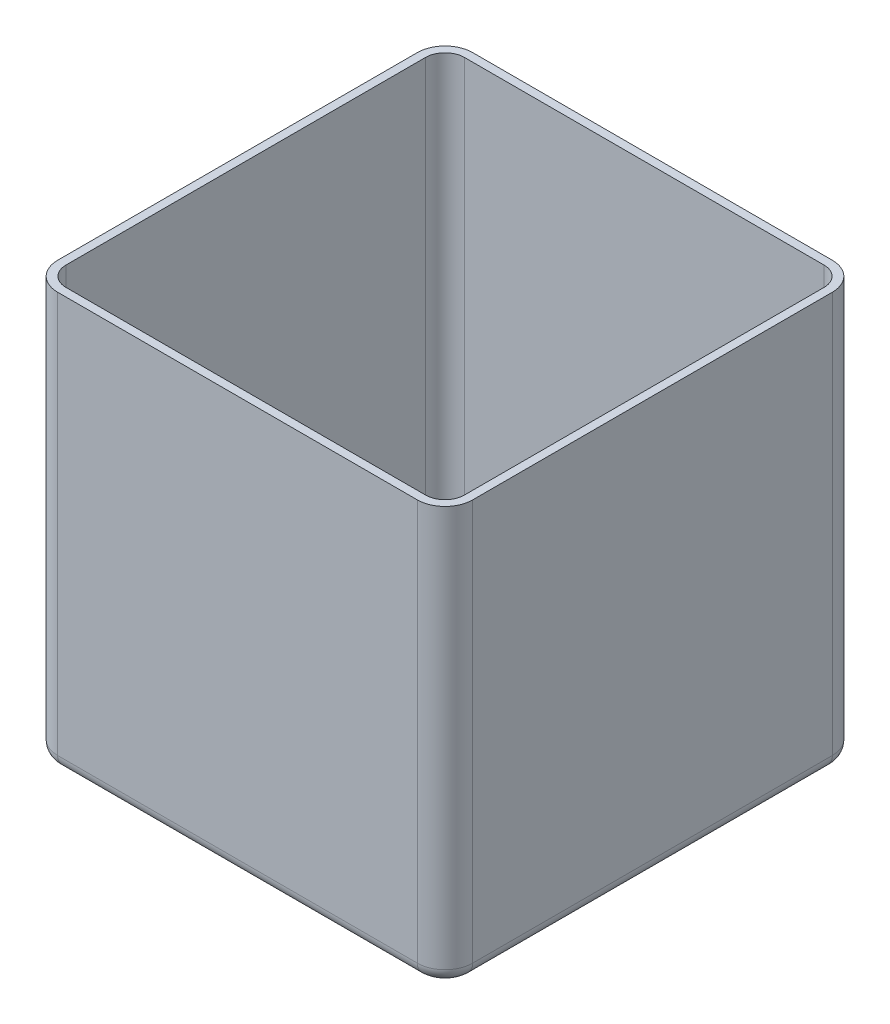
from build123d import *

# Parameters (mm, degrees)
CROQUIS1_W     = 150
CROQUIS1_H     = 150
EXTRUIR1_DEPTH = 150
REDONDEO1_R    = 10
REDONDEO2_R    = 5
VACIADO1_T     = -3


with BuildPart() as part:
    # Croquis1 → Extruir1 (new body)
    with BuildSketch(Plane(origin=(0, 0, 0), x_dir=(1, 0, 0), z_dir=(0, 1, 0))):
        Rectangle(CROQUIS1_W, CROQUIS1_H)
    extrude(amount=-EXTRUIR1_DEPTH)

    # Redondeo1
    redondeo1_edges = [part.edges().sort_by_distance(p)[0] for p in [
        (-75, -75, -75),
        (75, -75, -75),
        (75, -75, 75),
        (-75, -75, 75),
    ]]
    fillet(redondeo1_edges, radius=REDONDEO1_R)

    # Redondeo2
    redondeo2_edges = [part.edges().sort_by_distance(p)[0] for p in [
        (-75, -150, 0),
        (0, -150, 75),
        (0, -150, -75),
        (75, -150, 0),
        (72.071067812, -150, -72.071067812),
        (72.071067812, -150, 72.071067812),
        (-72.071067812, -150, -72.071067812),
        (-72.071067812, -150, 72.071067812),
    ]]
    fillet(redondeo2_edges, radius=REDONDEO2_R)

    # Vaciado1
    vaciado1_openings = [part.faces().sort_by_distance(p)[0] for p in [
        (0, 0, 0),
    ]]
    offset(amount=VACIADO1_T, openings=vaciado1_openings, kind=Kind.INTERSECTION)


solid = part.part
